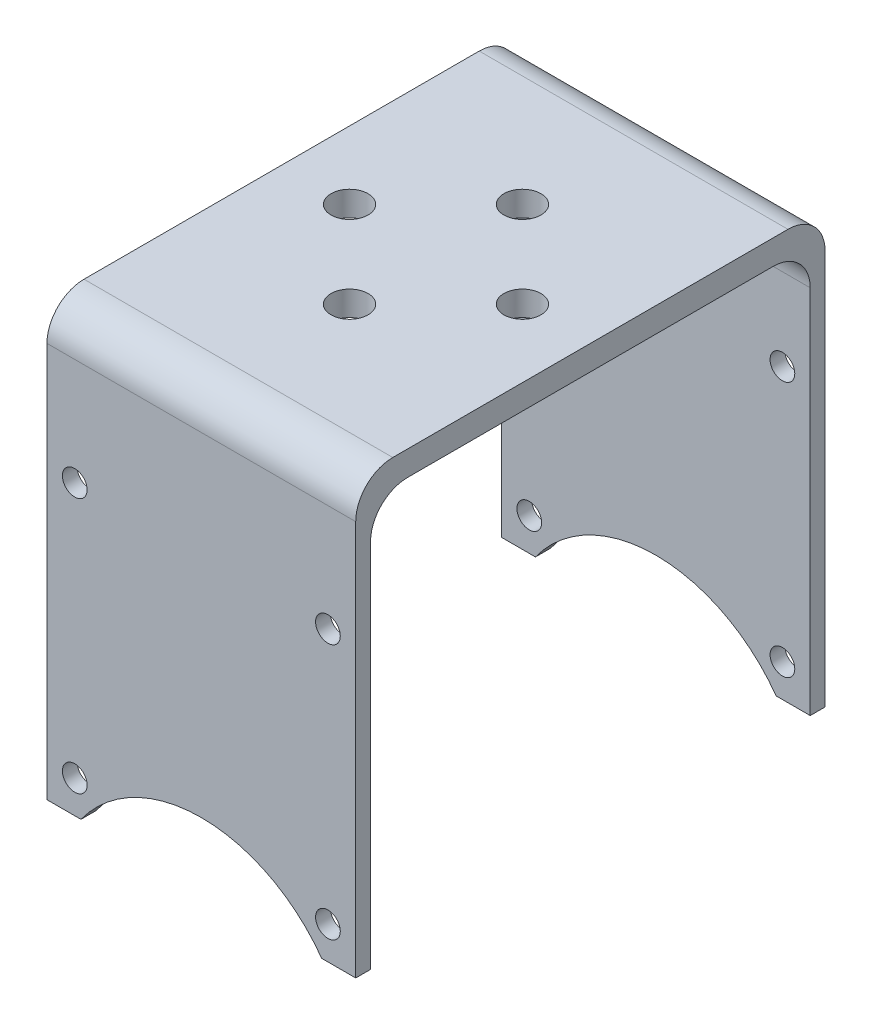
from build123d import *

# Parameters (mm, degrees)
EXTRUDE_1_DEPTH      = 2
SKETCH_4_W           = 25
SKETCH_4_H           = 1.2
EXTRUDE_3_DEPTH      = 40
FILLET_2_R           = 3
SKETCH_7_R           = 1
CUT_EXTRUDE_3_DEPTH  = 59.857879676
SKETCH_8_OUTSIDE_W   = 56.19
SKETCH_8_OUTSIDE_H   = 53.19
SKETCH_8_OUTSIDE_W_2 = 25
SKETCH_8_OUTSIDE_H_2 = 38
CUT_EXTRUDE_4_DEPTH  = 10
SKETCH_9_R           = 1.5
CUT_EXTRUDE_5_DEPTH  = 10


with BuildPart() as part:
    # 草图1 → 凸台-拉伸1 (new body)
    with BuildSketch(Plane(origin=(0, 0, 0), x_dir=(1, 0, 0), z_dir=(0, 1, 0))):
        Polygon((12.5, -10), (12.5, -19), (-12.5, -19), (-12.5, -10), (-20.5, -10), (-20.5, 10), (-12.5, 10), (-12.5, 19), (12.5, 19), (12.5, 10), (20.5, 10), (20.5, -10), align=None)
    extrude(amount=EXTRUDE_1_DEPTH)

    # 草图4 → 凸台-拉伸3 (add)
    with BuildSketch(Plane.XZ):
        with Locations((0, 18.4)):
            Rectangle(SKETCH_4_W, SKETCH_4_H)
        with Locations((0, -18.4)):
            Rectangle(SKETCH_4_W, SKETCH_4_H)
    extrude(amount=EXTRUDE_3_DEPTH)

    # 圆角2
    fillet_2_edges = [part.edges().sort_by_distance(p)[0] for p in [
        (0, 2, -19),
        (0, 2, 19),
        (0, 0, 17.8),
        (0, 0, -17.8),
    ]]
    fillet(fillet_2_edges, radius=FILLET_2_R)

    # 草图7 → 切除-拉伸3 (cut, through all)
    with BuildSketch(Plane.XY.offset(19)):
        with Locations((-10.25, -30.35)):
            Circle(SKETCH_7_R)
        with Locations((-10.25, -9.65)):
            Circle(SKETCH_7_R)
        with Locations((10.25, -9.65)):
            Circle(SKETCH_7_R)
        with Locations((10.25, -30.35)):
            Circle(SKETCH_7_R)
        with BuildLine():
            Line((-12.5, -33), (-9.746794345, -33))
            ThreePointArc((-9.746794345, -33), (0, -28), (9.746794345, -33))
            Line((9.746794345, -33), (12.5, -33))
            Line((12.5, -33), (12.5, -40))
            Line((12.5, -40), (-12.5, -40))
            Line((-12.5, -40), (-12.5, -33))
        make_face()
    extrude(amount=-CUT_EXTRUDE_3_DEPTH, mode=Mode.SUBTRACT)

    # 草图8 outside → 切除-拉伸4 (cut)
    with BuildSketch(Plane(origin=(0, 2, 0), x_dir=(1, 0, 0), z_dir=(0, 1, 0))):
        Rectangle(SKETCH_8_OUTSIDE_W, SKETCH_8_OUTSIDE_H)
        Rectangle(SKETCH_8_OUTSIDE_W_2, SKETCH_8_OUTSIDE_H_2, mode=Mode.SUBTRACT)
    extrude(amount=-CUT_EXTRUDE_4_DEPTH, mode=Mode.SUBTRACT)

    # 草图9 → 切除-拉伸5 (cut)
    with BuildSketch(Plane(origin=(0, 2, 0), x_dir=(1, 0, 0), z_dir=(0, 1, 0))):
        with Locations(Location((0, 7, 0), (0, 0, 270))):
            Circle(SKETCH_9_R)
        with Locations(Location((7, 0, 0), (0, 0, 270))):
            Circle(SKETCH_9_R)
        with Locations(Location((0, -7, 0), (0, 0, 270))):
            Circle(SKETCH_9_R)
        with Locations(Location((-7, 0, 0), (0, 0, 270))):
            Circle(SKETCH_9_R)
    extrude(amount=-CUT_EXTRUDE_5_DEPTH, mode=Mode.SUBTRACT)


solid = part.part
